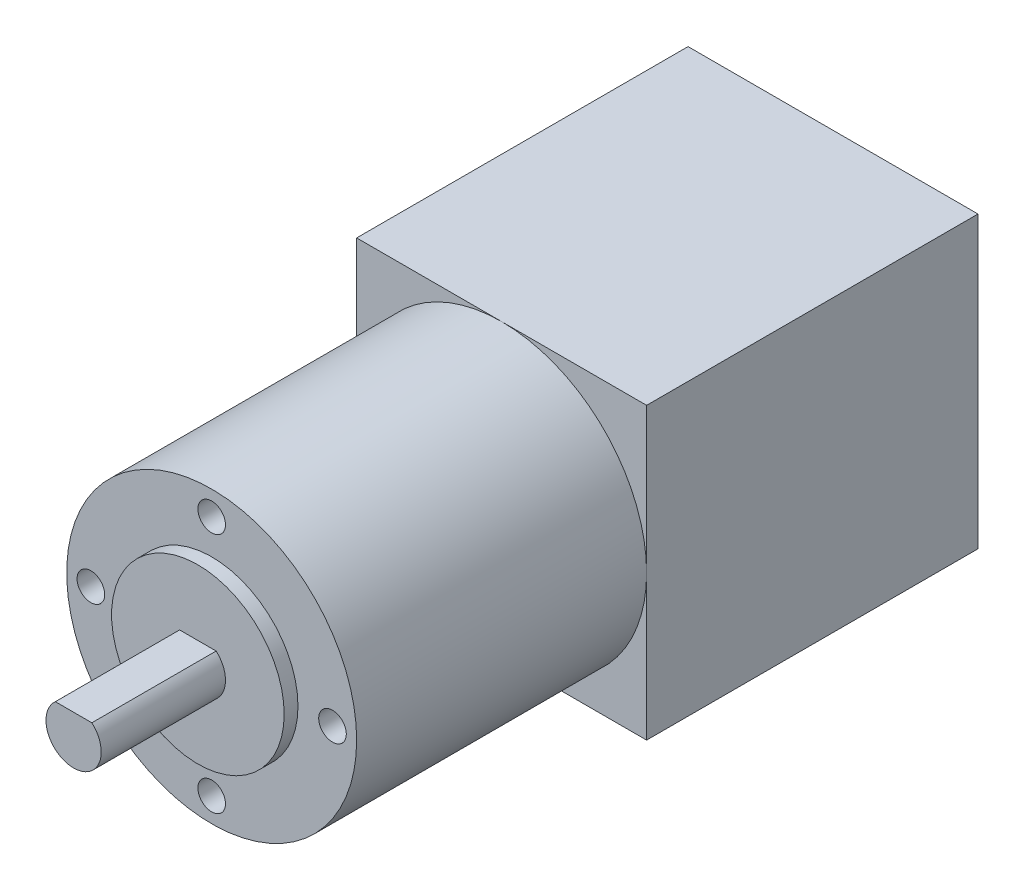
from build123d import *

# Parameters (mm, degrees)
SKETCH_1_W          = 42
SKETCH_1_H          = 42
EXTRUDE_1_DEPTH     = 48
SKETCH_2_R          = 21
EXTRUDE_2_DEPTH     = 42
SKETCH_3_R          = 12.5
EXTRUDE_3_DEPTH     = 2
EXTRUDE_4_DEPTH     = 18
SKETCH_5_R          = 2
CUT_EXTRUDE_1_DEPTH = 4


with BuildPart() as part:
    # 草图1 → 凸台-拉伸1 (new body)
    with BuildSketch(Plane.XY):
        Rectangle(SKETCH_1_W, SKETCH_1_H)
    extrude(amount=EXTRUDE_1_DEPTH)

    # 草图2 → 凸台-拉伸2 (add)
    with BuildSketch(Plane.XY.offset(48)):
        Circle(SKETCH_2_R)
    extrude(amount=EXTRUDE_2_DEPTH)

    # 草图3 → 凸台-拉伸3 (add)
    with BuildSketch(Plane.XY.offset(90)):
        Circle(SKETCH_3_R)
    extrude(amount=EXTRUDE_3_DEPTH)

    # 草图4 → 凸台-拉伸4 (add)
    with BuildSketch(Plane.XY.offset(92)):
        with BuildLine():
            Line((-2.645751311, 3), (2.645751311, 3))
            ThreePointArc((2.645751311, 3), (0, -4), (-2.645751311, 3))
        make_face()
    extrude(amount=EXTRUDE_4_DEPTH)

    # 草图5 → 切除-拉伸1 (cut)
    with BuildSketch(Plane.XY.offset(90)):
        with Locations((0, -17.5)):
            Circle(SKETCH_5_R)
        with Locations((-17.5, 0)):
            Circle(SKETCH_5_R)
        with Locations((0, 17.5)):
            Circle(SKETCH_5_R)
        with Locations((17.5, 0)):
            Circle(SKETCH_5_R)
    extrude(amount=-CUT_EXTRUDE_1_DEPTH, mode=Mode.SUBTRACT)


solid = part.part
